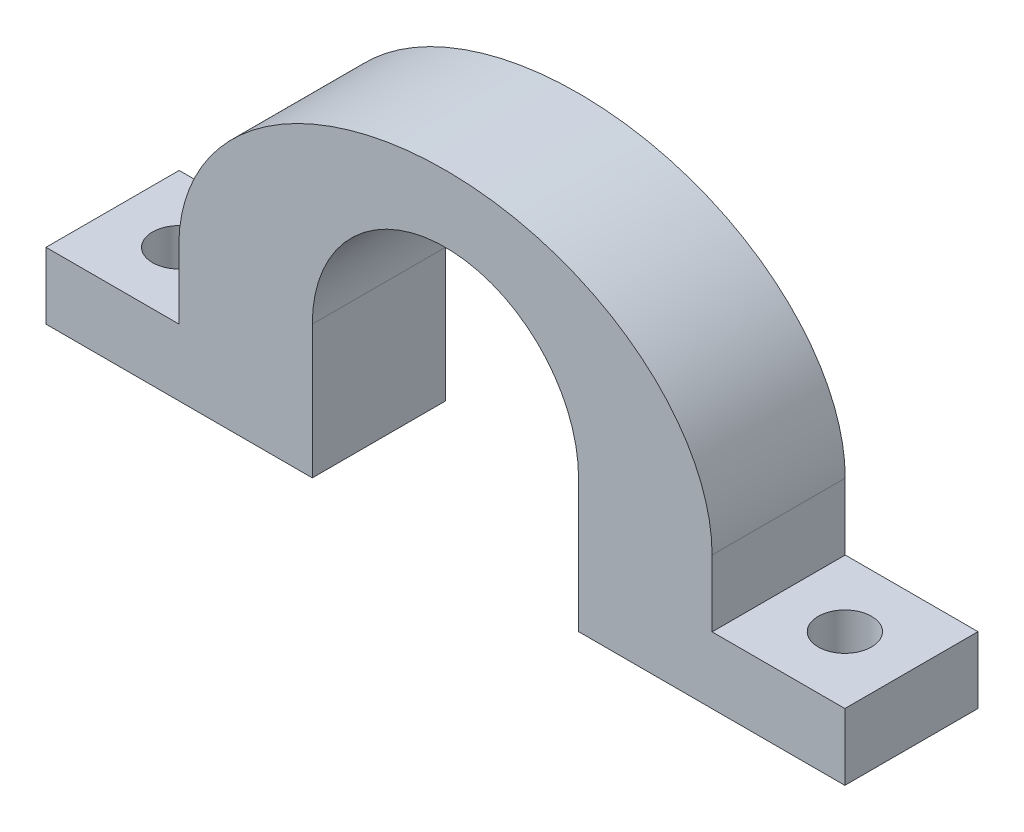
from build123d import *

# Parameters (mm, degrees)
BOSS_EXTRUDE1_DEPTH = 10
SKETCH2_R           = 2
CUT_EXTRUDE1_DEPTH  = 38.428296148


with BuildPart() as part:
    # Sketch1 → Boss-Extrude1 (new body)
    with BuildSketch(Plane.XY):
        with BuildLine():
            Line((-30, -5), (-30, -10))
            Line((-30, -10), (-10, -10))
            Line((-10, -10), (-10, 0))
            ThreePointArc((-10, 0), (0, 10), (10, 0))
            Line((10, 0), (10, -10))
            Line((10, -10), (30, -10))
            Line((30, -10), (30, -5))
            Line((30, -5), (20.029228667, -5))
            Line((20.029228667, -5), (20.029228667, 0))
            add(Edge.make_bspline(
                [(20.029228667, 0), (20.029228667, 15.433325749), (-0.541030341, 15.016440125), (-21.111289348, 14.599554502), (-20, -0.811249385)],
                knots=[0, 0, 0, 1.597811653, 1.597811653, 3.195623307, 3.195623307, 3.195623307], degree=2, weights=[1, 0.697491204, 1, 0.697491204, 1]))
            Line((-20, -0.811249385), (-20, -5))
            Line((-20, -5), (-30, -5))
        make_face()
    extrude(amount=BOSS_EXTRUDE1_DEPTH)

    # Sketch2 → Cut-Extrude1 (cut, through all)
    with BuildSketch(Plane(origin=(0, -5, 0), x_dir=(1, 0, 0), z_dir=(0, 1, 0))):
        with Locations(Location((-25, -5, 0), (0, 0, 270))):
            Circle(SKETCH2_R)
        with Locations(Location((25, -5, 0), (0, 0, 270))):
            Circle(SKETCH2_R)
    extrude(amount=-CUT_EXTRUDE1_DEPTH, mode=Mode.SUBTRACT)


solid = part.part
